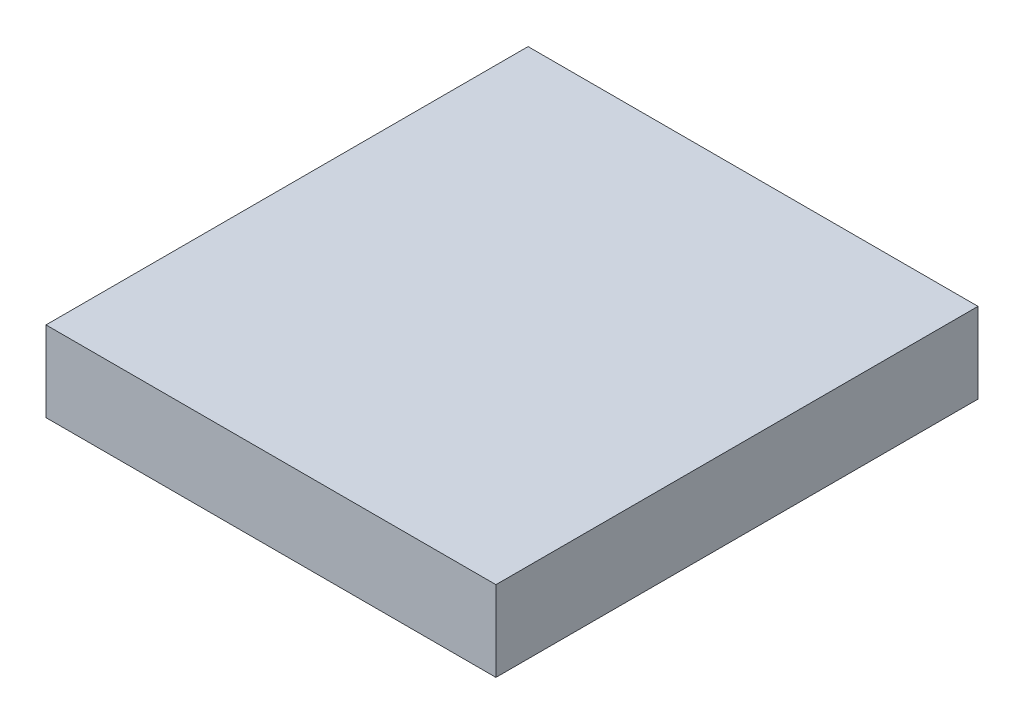
from build123d import *

# Parameters (mm, degrees)
SKETCH1_W           = 28
SKETCH1_H           = 30
BOSS_EXTRUDE1_DEPTH = 5


with BuildPart() as part:
    # Sketch1 → Boss-Extrude1 (new body)
    with BuildSketch(Plane(origin=(0, 0, 0), x_dir=(1, 0, 0), z_dir=(0, 1, 0))):
        with Locations((14, 15)):
            Rectangle(SKETCH1_W, SKETCH1_H)
    extrude(amount=BOSS_EXTRUDE1_DEPTH)


solid = part.part
